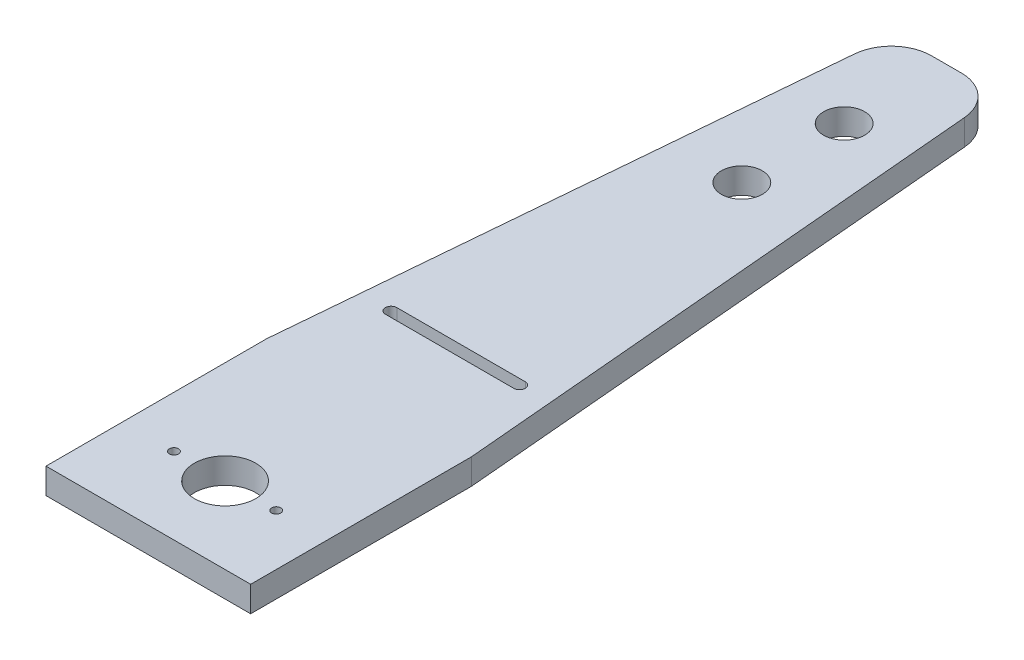
from build123d import *

# Parameters (mm, degrees)
SKETCH1_W           = 50.8
SKETCH1_H           = 198.12
SKETCH1_R           = 1.1303
SKETCH1_R_2         = 7.62
BOSS_EXTRUDE1_DEPTH = 6.35
SKETCH2_R           = 5.08
CUT_EXTRUDE1_DEPTH  = 6.35
CHAMFER1_SIZE       = 12.54
CHAMFER1_SIZE2      = 143.332855877
FILLET1_R           = 10
CUT_EXTRUDE2_DEPTH  = 10.668


with BuildPart() as part:
    # Sketch1 → Boss-Extrude1 (new body)
    with BuildSketch(Plane(origin=(0, 0, 0), x_dir=(1, 0, 0), z_dir=(0, 1, 0))):
        with Locations((25.4, 99.06)):
            Rectangle(SKETCH1_W, SKETCH1_H)
        with Locations(Location((12.7, 19.05, 0), (0, 0, 270))):
            Circle(SKETCH1_R, mode=Mode.SUBTRACT)
        with Locations(Location((38.1, 19.05, 0), (0, 0, 270))):
            Circle(SKETCH1_R, mode=Mode.SUBTRACT)
        with Locations(Location((25.4, 19.05, 0), (0, 0, 270))):
            Circle(SKETCH1_R_2, mode=Mode.SUBTRACT)
    extrude(amount=BOSS_EXTRUDE1_DEPTH)

    # Sketch2 → Cut-Extrude1 (cut)
    with BuildSketch(Plane(origin=(0, 6.35, 0), x_dir=(1, 0, 0), z_dir=(0, 1, 0))):
        with Locations(Location((25.4, 172.72, 0), (0, 0, 270))):
            Circle(SKETCH2_R)
        with Locations(Location((25.4, 147.32, 0), (0, 0, 270))):
            Circle(SKETCH2_R)
    extrude(amount=-CUT_EXTRUDE1_DEPTH, mode=Mode.SUBTRACT)

    # Chamfer1
    chamfer1_edges = [part.edges().sort_by_distance(p)[0] for p in [
        (0, 3.175, -198.12),
        (50.8, 3.175, -198.12),
    ]]
    chamfer1_side = [part.faces().sort_by_distance(p)[0] for p in [
        (25.4, 3.175, -198.12),
    ]]
    chamfer(chamfer1_edges, length=CHAMFER1_SIZE, length2=CHAMFER1_SIZE2, reference=chamfer1_side[0])

    # Fillet1
    fillet1_edges = [part.edges().sort_by_distance(p)[0] for p in [
        (12.54, 3.175, -198.12),
        (38.26, 3.175, -198.12),
    ]]
    fillet(fillet1_edges, radius=FILLET1_R)

    # Sketch3 → Cut-Extrude2 (cut)
    with BuildSketch(Plane(origin=(0, 6.35, 0), x_dir=(1, 0, 0), z_dir=(0, 1, 0))):
        with BuildLine():
            Line((9.459358265, 77.6224), (41.340641735, 77.6224))
            ThreePointArc((41.340641735, 77.6224), (42.763041735, 76.2), (41.340641735, 74.7776))
            Line((41.340641735, 74.7776), (9.459358265, 74.7776))
            ThreePointArc((9.459358265, 74.7776), (8.036958265, 76.2), (9.459358265, 77.6224))
        make_face()
    extrude(amount=-CUT_EXTRUDE2_DEPTH, mode=Mode.SUBTRACT)


solid = part.part
